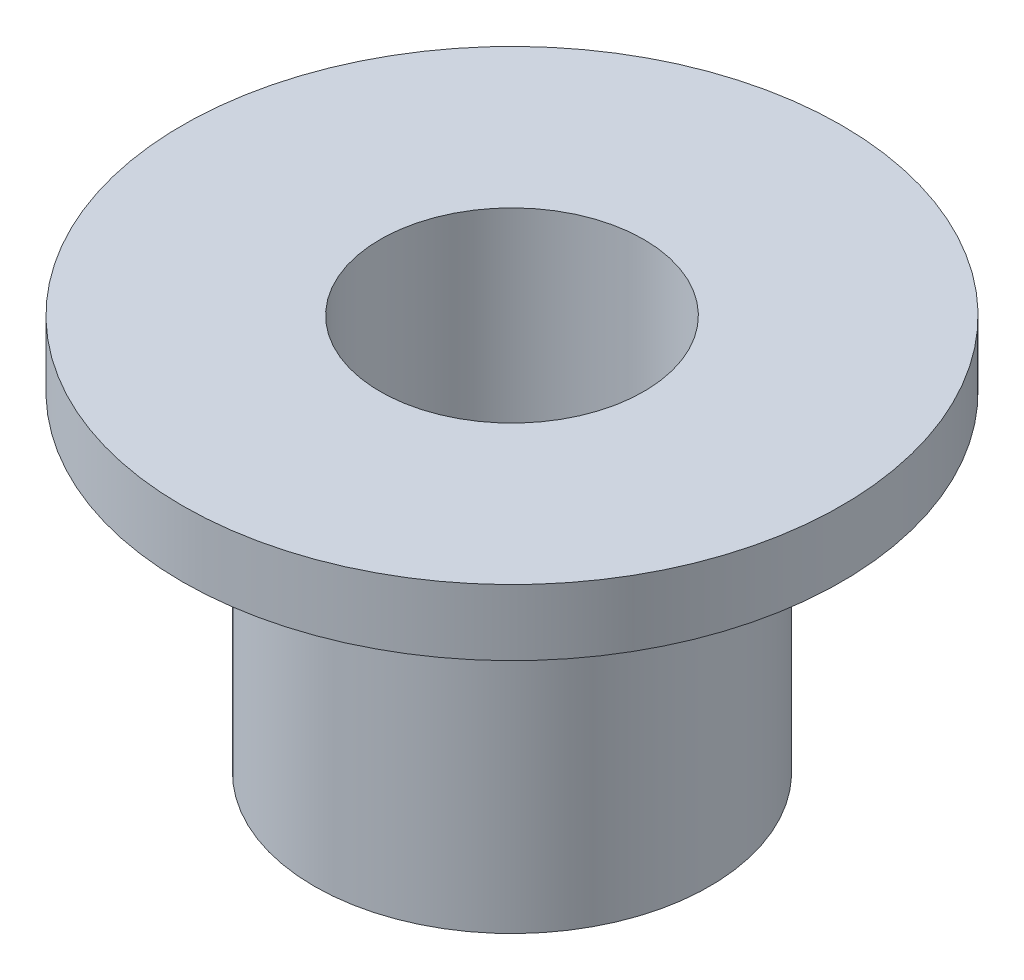
from build123d import *


with BuildPart() as part:
    # Sketch2 → Revolve1 (revolve)
    with BuildSketch(Plane.XY, mode=Mode.PRIVATE) as revolve1_sk:
        Polygon((-2, 0), (-2, 6), (-5, 6), (-5, 5), (-3, 5), (-3, 0), align=None)
    revolve(revolve1_sk.sketch.rotate(Axis((0, 0, 0), (0, 1, 0)), 270), axis=Axis((0, 0, 0), (0, 1, 0)))


solid = part.part
